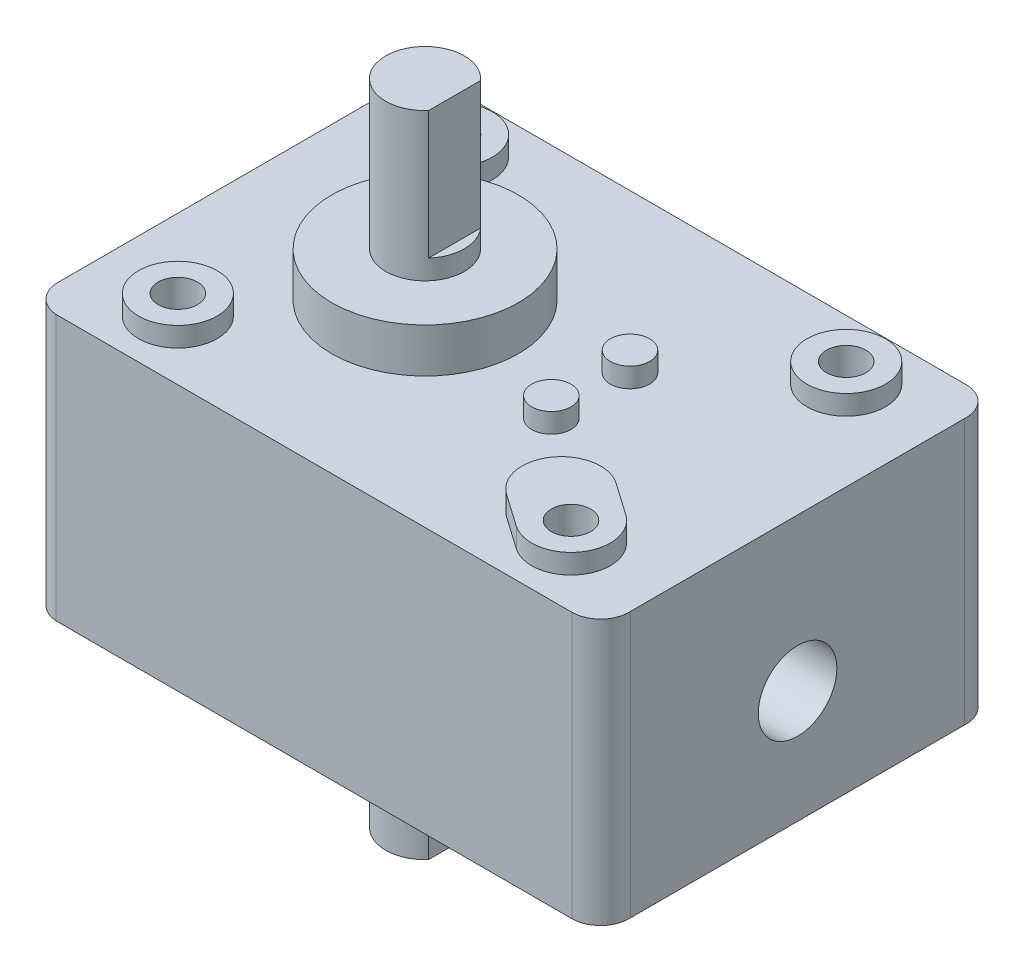
from build123d import *

# Parameters (mm, degrees)
SALIENTE_EXTRUIR1_DEPTH = 27
CROQUIS3_R              = 4
CROQUIS3_R_2            = 2
SALIENTE_EXTRUIR2_DEPTH = 2
CROQUIS6_R              = 2
CORTAR_EXTRUIR2_DEPTH   = 10
SALIENTE_EXTRUIR4_START = 2
CROQUIS9_R              = 4
CROQUIS9_R_2            = 2
SALIENTE_EXTRUIR4_DEPTH = 2
CORTAR_EXTRUIR3_START   = -10
CROQUIS10_R             = 2
CORTAR_EXTRUIR3_DEPTH   = 10
CROQUIS11_R             = 9.5
SALIENTE_EXTRUIR5_DEPTH = 4.5
SALIENTE_EXTRUIR6_START = 4.5
CROQUIS12_R             = 9.5
SALIENTE_EXTRUIR6_DEPTH = 4.5
CROQUIS13_R             = 4
SALIENTE_EXTRUIR7_DEPTH = 15
CORTAR_EXTRUIR6_START   = -13
CORTAR_EXTRUIR6_DEPTH   = 13
SALIENTE_EXTRUIR8_START = 15
CROQUIS16_R             = 4
SALIENTE_EXTRUIR8_DEPTH = 15
CORTAR_EXTRUIR7_DEPTH   = 13
CROQUIS18_R             = 4
CORTAR_EXTRUIR8_DEPTH   = 20


with BuildPart() as part:
    # Croquis2 → Saliente-Extruir1 (new body)
    with BuildSketch(Plane(origin=(0, 0, 0), x_dir=(1, 0, 0), z_dir=(0, 1, 0))):
        with BuildLine():
            Line((-26.320513929, 20.055), (26.15, 20.055))
            ThreePointArc((26.15, 20.055), (28.26352098, 19.143001272), (29.05, 16.97963275))
            Line((29.05, 16.97963275), (29.05, -16.97963275))
            ThreePointArc((29.05, -16.97963275), (28.26352098, -19.143001272), (26.15, -20.055))
            Line((26.15, -20.055), (-26.320513929, -20.055))
            ThreePointArc((-26.320513929, -20.055), (-28.26710835, -19.146484969), (-29.06, -17.15))
            Line((-29.06, -17.15), (-29.06, 17.15))
            ThreePointArc((-29.06, 17.15), (-28.26710835, 19.146484969), (-26.320513929, 20.055))
        make_face()
    extrude(amount=SALIENTE_EXTRUIR1_DEPTH)

    # Croquis3 → Saliente-Extruir2 (add)
    with BuildSketch(Plane(origin=(0, 27, 0), x_dir=(1, 0, 0), z_dir=(0, 1, 0))):
        with BuildLine():
            Line((22.293849377, -10.723072318), (19.016921695, -8.42922294))
            ThreePointArc((19.016921695, -8.42922294), (13.446144636, -9.412301245), (14.42922294, -14.983078305))
            Line((14.42922294, -14.983078305), (17.706150623, -17.276927682))
            ThreePointArc((17.706150623, -17.276927682), (23.276927682, -16.293849377), (22.293849377, -10.723072318))
        make_face()
        with Locations(Location((-20, 14, 0), (0, 0, 270))):
            Circle(CROQUIS3_R)
        with Locations(Location((20, 14, 0), (0, 0, 270))):
            Circle(CROQUIS3_R)
        with Locations(Location((-20, -14, 0), (0, 0, 270))):
            Circle(CROQUIS3_R)
        with Locations(Location((8, 4, 0), (0, 0, 270))):
            Circle(CROQUIS3_R_2)
        with Locations(Location((8, -4, 0), (0, 0, 270))):
            Circle(CROQUIS3_R_2)
    extrude(amount=SALIENTE_EXTRUIR2_DEPTH)

    # Croquis6 → Cortar-Extruir2 (cut)
    with BuildSketch(Plane(origin=(0, 29, 0), x_dir=(1, 0, 0), z_dir=(0, 1, 0))):
        with Locations(Location((-20, 14, 0), (0, 0, 270))):
            Circle(CROQUIS6_R)
        with Locations(Location((20, 14, 0), (0, 0, 270))):
            Circle(CROQUIS6_R)
        with Locations(Location((20, -14, 0), (0, 0, 270))):
            Circle(CROQUIS6_R)
        with Locations(Location((-20, -14, 0), (0, 0, 270))):
            Circle(CROQUIS6_R)
    extrude(amount=-CORTAR_EXTRUIR2_DEPTH, mode=Mode.SUBTRACT)

    # Croquis9 → Saliente-Extruir4 (add)
    with BuildSketch(Plane.XZ.offset(SALIENTE_EXTRUIR4_START)):
        with Locations(Location((-20, 14, 0), (0, 0, 90))):
            Circle(CROQUIS9_R)
        with Locations(Location((-20, -14, 0), (0, 0, 90))):
            Circle(CROQUIS9_R)
        with Locations(Location((8, 4, 0), (0, 0, 90))):
            Circle(CROQUIS9_R_2)
        with Locations(Location((8, -4, 0), (0, 0, 90))):
            Circle(CROQUIS9_R_2)
        with Locations(Location((20, -14, 0), (0, 0, 90))):
            Circle(CROQUIS9_R)
        with BuildLine():
            Line((14.255148366, 14.861221242), (17.535309468, 17.150444505))
            ThreePointArc((17.535309468, 17.150444505), (23.214821143, 16.380110295), (22.293849377, 10.723072318))
            Line((22.293849377, 10.723072318), (18.838221007, 8.304132458))
            ThreePointArc((18.838221007, 8.304132458), (13.265826422, 9.28952325), (14.255148366, 14.861221242))
        make_face()
    extrude(amount=-SALIENTE_EXTRUIR4_DEPTH)

    # Croquis10 → Cortar-Extruir3 (cut)
    with BuildSketch(Plane.XZ.offset(2).offset(CORTAR_EXTRUIR3_START)):
        with Locations(Location((20, -14, 0), (0, 0, 90))):
            Circle(CROQUIS10_R)
        with Locations(Location((20, 14, 0), (0, 0, 90))):
            Circle(CROQUIS10_R)
        with Locations(Location((-20, 14, 0), (0, 0, 90))):
            Circle(CROQUIS10_R)
        with Locations(Location((-20, -14, 0), (0, 0, 90))):
            Circle(CROQUIS10_R)
    extrude(amount=CORTAR_EXTRUIR3_DEPTH, mode=Mode.SUBTRACT)

    # Croquis11 → Saliente-Extruir5 (add)
    with BuildSketch(Plane(origin=(0, 27, 0), x_dir=(1, 0, 0), z_dir=(0, 1, 0))):
        with Locations(Location((-8.85, 0, 0), (0, 0, 270))):
            Circle(CROQUIS11_R)
    extrude(amount=SALIENTE_EXTRUIR5_DEPTH)

    # Croquis12 → Saliente-Extruir6 (add)
    with BuildSketch(Plane.XZ.offset(SALIENTE_EXTRUIR6_START)):
        with Locations(Location((-8.85, 0, 0), (0, 0, 90))):
            Circle(CROQUIS12_R)
    extrude(amount=-SALIENTE_EXTRUIR6_DEPTH)

    # Croquis13 → Saliente-Extruir7 (add)
    with BuildSketch(Plane(origin=(0, 31.5, 0), x_dir=(1, 0, 0), z_dir=(0, 1, 0))):
        with Locations(Location((-8.85, 0, 0), (0, 0, 270))):
            Circle(CROQUIS13_R)
    extrude(amount=SALIENTE_EXTRUIR7_DEPTH)

    # Croquis15 → Cortar-Extruir6 (cut)
    with BuildSketch(Plane(origin=(0, 46.5, 0), x_dir=(1, 0, 0), z_dir=(0, 1, 0)).offset(CORTAR_EXTRUIR6_START)):
        with BuildLine():
            Line((-5.85, 2.645751311), (-5.85, -2.645751311))
            ThreePointArc((-5.85, -2.645751311), (-4.85, 0), (-5.85, 2.645751311))
        make_face()
    extrude(amount=CORTAR_EXTRUIR6_DEPTH, mode=Mode.SUBTRACT)

    # Croquis16 → Saliente-Extruir8 (add)
    with BuildSketch(Plane.XZ.offset(4.5).offset(SALIENTE_EXTRUIR8_START)):
        with Locations(Location((-8.85, 0, 0), (0, 0, 318.590377891))):
            Circle(CROQUIS16_R)
    extrude(amount=-SALIENTE_EXTRUIR8_DEPTH)

    # Croquis17 → Cortar-Extruir7 (cut)
    with BuildSketch(Plane.XZ.offset(19.5)):
        with BuildLine():
            Line((-5.85, 2.645751311), (-5.85, -2.645751311))
            ThreePointArc((-5.85, -2.645751311), (-4.85, 0), (-5.85, 2.645751311))
        make_face()
    extrude(amount=-CORTAR_EXTRUIR7_DEPTH, mode=Mode.SUBTRACT)

    # Croquis18 → Cortar-Extruir8 (cut)
    with BuildSketch(Plane(origin=(29.05, 0, 0), x_dir=(0, 0, -1), z_dir=(1, 0, 0))):
        with Locations((0, 11.5)):
            Circle(CROQUIS18_R)
    extrude(amount=-CORTAR_EXTRUIR8_DEPTH, mode=Mode.SUBTRACT)


solid = part.part
